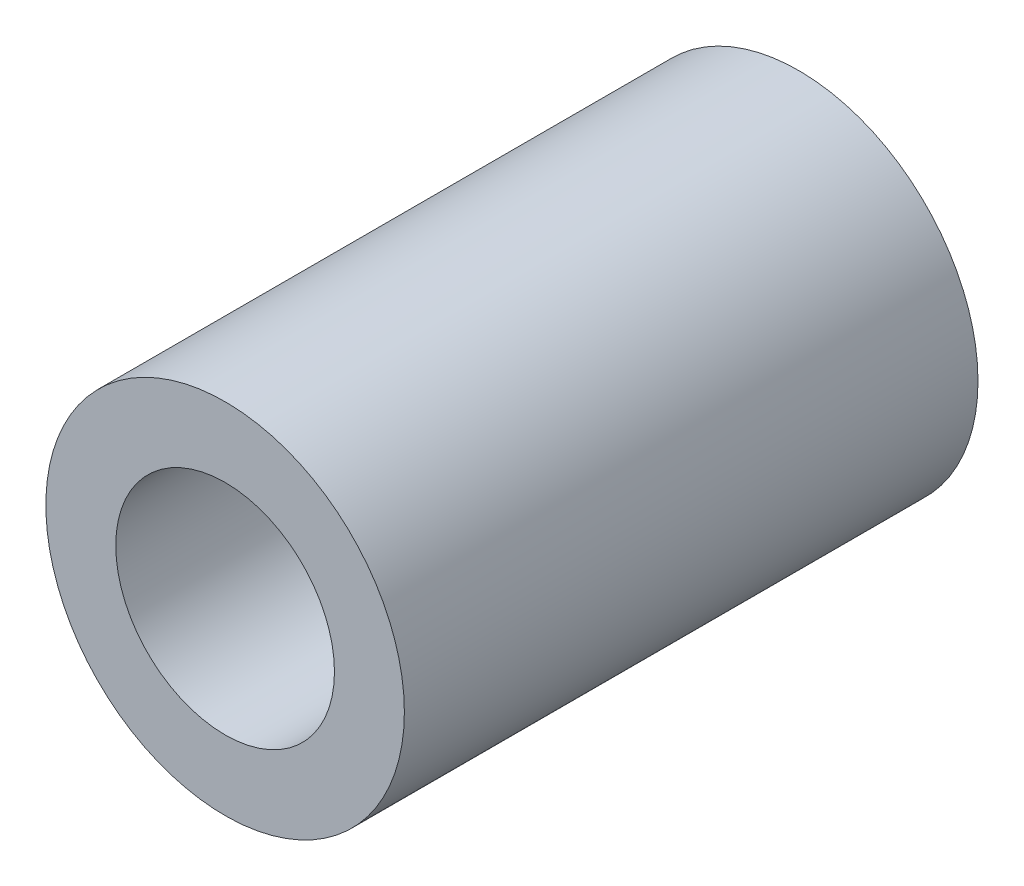
from build123d import *

# Parameters (mm, degrees)
SKETCH1_R           = 5
SKETCH1_R_2         = 3.05
BOSS_EXTRUDE1_DEPTH = 16


with BuildPart() as part:
    # Sketch1 → Boss-Extrude1 (new body)
    with BuildSketch(Plane.XY):
        Circle(SKETCH1_R)
        Circle(SKETCH1_R_2, mode=Mode.SUBTRACT)
    extrude(amount=BOSS_EXTRUDE1_DEPTH)


solid = part.part
